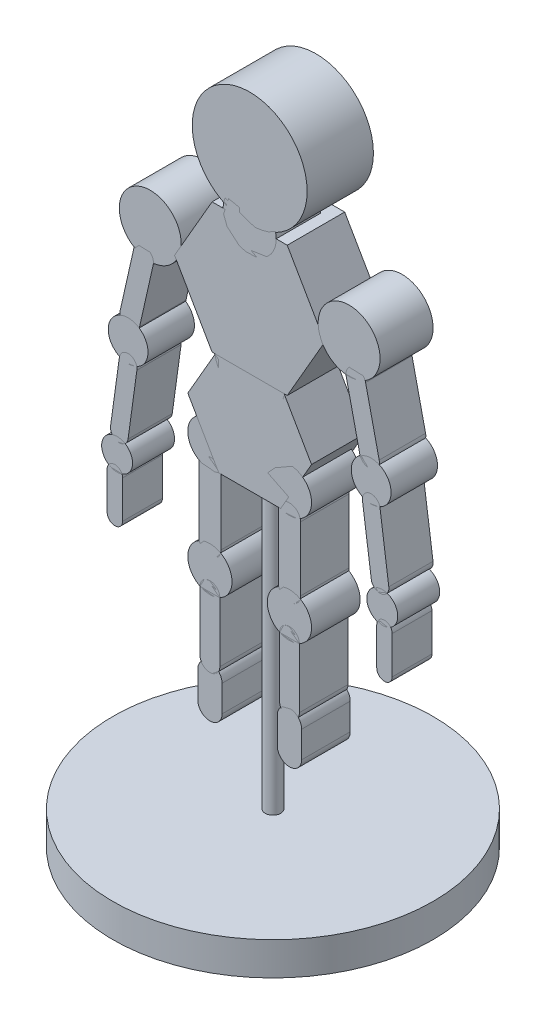
from build123d import *

# Parameters (mm, degrees)
EXTRUDE_2_DEPTH  = 22
EXTRUDE_3_DEPTH  = 22
EXTRUDE_4_DEPTH  = 22
SKETCH_5_R       = 10
EXTRUDE_5_DEPTH  = 22
EXTRUDE_6_DEPTH  = 22
SKETCH_7_R       = 10
EXTRUDE_7_DEPTH  = 22
EXTRUDE_8_DEPTH  = 22
SKETCH_9_R       = 10
EXTRUDE_9_DEPTH  = 22
EXTRUDE_10_DEPTH = 22
SKETCH_11_R      = 10
EXTRUDE_11_DEPTH = 22
EXTRUDE_12_DEPTH = 24
SKETCH_13_R      = 16
EXTRUDE_13_DEPTH = 22
EXTRUDE_14_DEPTH = 26
SKETCH_15_R      = 12
EXTRUDE_15_DEPTH = 20
SKETCH_16_R      = 26
EXTRUDE_16_DEPTH = 30
SKETCH_17_R      = 14
EXTRUDE_17_DEPTH = 24
EXTRUDE_18_DEPTH = 21
SKETCH_19_R      = 9
EXTRUDE_19_DEPTH = 21
EXTRUDE_20_DEPTH = 20
SKETCH_21_R      = 7
EXTRUDE_21_DEPTH = 19
EXTRUDE_22_DEPTH = 18
SKETCH_23_R      = 14
EXTRUDE_23_DEPTH = 24
EXTRUDE_24_DEPTH = 21
SKETCH_25_R      = 9
EXTRUDE_25_DEPTH = 21
EXTRUDE_26_DEPTH = 20
SKETCH_27_R      = 7
EXTRUDE_27_DEPTH = 19
EXTRUDE_28_DEPTH = 18
SKETCH_29_R      = 3.5
EXTRUDE_29_DEPTH = 130
SKETCH_30_R      = 72.5
EXTRUDE_30_DEPTH = 15


with BuildPart() as part:
    # 草图2 → 凸台-拉伸2 (new body)
    with BuildSketch(Plane.XY):
        with BuildLine():
            Line((-23.5, -111), (-23.5, -99))
            ThreePointArc((-23.5, -99), (-18, -93.5), (-12.5, -99))
            Line((-12.5, -99), (-12.5, -111))
            ThreePointArc((-12.5, -111), (-18, -116.5), (-23.5, -111))
        make_face()
    extrude(amount=-EXTRUDE_2_DEPTH)


with BuildPart() as body_2:
    # 草图3 → 凸台-拉伸3 (new body)
    with BuildSketch(Plane.XY):
        with BuildLine():
            Line((12.5, -111), (12.5, -99))
            ThreePointArc((12.5, -99), (18, -93.5), (23.5, -99))
            Line((23.5, -99), (23.5, -111))
            ThreePointArc((23.5, -111), (18, -116.5), (12.5, -111))
        make_face()
    extrude(amount=-EXTRUDE_3_DEPTH)


with BuildPart() as body_3:
    # 草图4 → 凸台-拉伸4 (new body)
    with BuildSketch(Plane.XY):
        with BuildLine():
            Line((-22.5, -93), (-22.5, -66))
            ThreePointArc((-22.5, -66), (-18, -61.5), (-13.5, -66))
            Line((-13.5, -66), (-13.5, -93))
            ThreePointArc((-13.5, -93), (-18, -97.5), (-22.5, -93))
        make_face()
    extrude(amount=-EXTRUDE_4_DEPTH)


with BuildPart() as body_4:
    # 草图5 → 凸台-拉伸5 (new body)
    with BuildSketch(Plane.XY):
        with Locations((-18, -57)):
            Circle(SKETCH_5_R)
    extrude(amount=-EXTRUDE_5_DEPTH)


with BuildPart() as body_5:
    # 草图6 → 凸台-拉伸6 (new body)
    with BuildSketch(Plane.XY):
        with BuildLine():
            Line((-23, -47), (-23, -18))
            ThreePointArc((-23, -18), (-18, -13), (-13, -18))
            Line((-13, -18), (-13, -47))
            ThreePointArc((-13, -47), (-18, -52), (-23, -47))
        make_face()
    extrude(amount=-EXTRUDE_6_DEPTH)


with BuildPart() as body_6:
    # 草图7 → 凸台-拉伸7 (new body)
    with BuildSketch(Plane.XY):
        with Locations((-18, -8)):
            Circle(SKETCH_7_R)
    extrude(amount=-EXTRUDE_7_DEPTH)


with BuildPart() as body_7:
    # 草图8 → 凸台-拉伸8 (new body)
    with BuildSketch(Plane.XY):
        with BuildLine():
            Line((13.5, -93), (13.5, -66))
            ThreePointArc((13.5, -66), (18, -61.5), (22.5, -66))
            Line((22.5, -66), (22.5, -93))
            ThreePointArc((22.5, -93), (18, -97.5), (13.5, -93))
        make_face()
    extrude(amount=-EXTRUDE_8_DEPTH)


with BuildPart() as body_8:
    # 草图9 → 凸台-拉伸9 (new body)
    with BuildSketch(Plane.XY):
        with Locations((18, -57)):
            Circle(SKETCH_9_R)
    extrude(amount=-EXTRUDE_9_DEPTH)


with BuildPart() as body_9:
    # 草图10 → 凸台-拉伸10 (new body)
    with BuildSketch(Plane.XY):
        with BuildLine():
            Line((13, -47), (13, -18))
            ThreePointArc((13, -18), (18, -13), (23, -18))
            Line((23, -18), (23, -47))
            ThreePointArc((23, -47), (18, -52), (13, -47))
        make_face()
    extrude(amount=-EXTRUDE_10_DEPTH)


with BuildPart() as body_10:
    # 草图11 → 凸台-拉伸11 (new body)
    with BuildSketch(Plane.XY):
        with Locations((18, -8)):
            Circle(SKETCH_11_R)
    extrude(amount=-EXTRUDE_11_DEPTH)


with BuildPart() as body_11:
    # 草图12 → 凸台-拉伸12 (new body)
    with BuildSketch(Plane.XY):
        Polygon((28, 7), (14, 31.248711306), (-14, 31.248711306), (-28, 7), (-14, -17.248711306), (14, -17.248711306), align=None)
    extrude(amount=-EXTRUDE_12_DEPTH)

    # 草图29 → 凸台-拉伸29 (add)
    with BuildSketch(Plane.XZ.offset(17.248711306)):
        with Locations((0, -10.528596481)):
            Circle(SKETCH_29_R)
    extrude(amount=EXTRUDE_29_DEPTH)

    # 草图30 → 凸台-拉伸30 (add)
    with BuildSketch(Plane.XZ.offset(147.248711306)):
        with Locations((0, -10.528596481)):
            Circle(SKETCH_30_R)
    extrude(amount=EXTRUDE_30_DEPTH)


with BuildPart() as body_12:
    # 草图13 → 凸台-拉伸13 (new body)
    with BuildSketch(Plane.XY):
        with Locations((0, 31.248711306)):
            Circle(SKETCH_13_R)
    extrude(amount=-EXTRUDE_13_DEPTH)


with BuildPart() as body_13:
    # 草图14 → 凸台-拉伸14 (new body)
    with BuildSketch(Plane.XY):
        Polygon((34, 58), (17, 87.444863729), (-17, 87.444863729), (-34, 58), (-17, 28.555136271), (17, 28.555136271), align=None)
    extrude(amount=-EXTRUDE_14_DEPTH)


with BuildPart() as body_14:
    # 草图15 → 凸台-拉伸15 (new body)
    with BuildSketch(Plane.XY):
        with Locations((0, 87.444863729)):
            Circle(SKETCH_15_R)
    extrude(amount=-EXTRUDE_15_DEPTH)


with BuildPart() as body_15:
    # 草图16 → 凸台-拉伸16 (new body)
    with BuildSketch(Plane.XY):
        with Locations((0, 113)):
            Circle(SKETCH_16_R)
    extrude(amount=-EXTRUDE_16_DEPTH)


with BuildPart() as body_16:
    # 草图17 → 凸台-拉伸17 (new body)
    with BuildSketch(Plane.XY):
        with Locations((-45, 64)):
            Circle(SKETCH_17_R)
    extrude(amount=-EXTRUDE_17_DEPTH)


with BuildPart() as body_17:
    # 草图18 → 凸台-拉伸18 (new body)
    with BuildSketch(Plane.XY):
        with BuildLine():
            Line((-43.682926829, 49.353658537), (-49.823914337, 22.060380726))
            ThreePointArc((-49.823914337, 22.060380726), (-55.201963117, 18.657941701), (-58.604402142, 24.035990482))
            Line((-58.604402142, 24.035990482), (-52.463414634, 51.329268293))
            ThreePointArc((-52.463414634, 51.329268293), (-47.085365854, 54.731707317), (-43.682926829, 49.353658537))
        make_face()
    extrude(amount=-EXTRUDE_18_DEPTH)


with BuildPart() as body_18:
    # 草图19 → 凸台-拉伸19 (new body)
    with BuildSketch(Plane.XY):
        with Locations((-55, 14)):
            Circle(SKETCH_19_R)
    extrude(amount=-EXTRUDE_19_DEPTH)


with BuildPart() as body_19:
    # 草图20 → 凸台-拉伸20 (new body)
    with BuildSketch(Plane.XY):
        with BuildLine():
            Line((-51.037515483, 4.453450411), (-55.037515483, -24.546549589))
            ThreePointArc((-55.037515483, -24.546549589), (-59.546549589, -27.962484517), (-62.962484517, -23.453450411))
            Line((-62.962484517, -23.453450411), (-58.962484517, 5.546549589))
            ThreePointArc((-58.962484517, 5.546549589), (-54.453450411, 8.962484517), (-51.037515483, 4.453450411))
        make_face()
    extrude(amount=-EXTRUDE_20_DEPTH)


with BuildPart() as body_20:
    # 草图21 → 凸台-拉伸21 (new body)
    with BuildSketch(Plane.XY):
        with Locations((-60, -33)):
            Circle(SKETCH_21_R)
    extrude(amount=-EXTRUDE_21_DEPTH)


with BuildPart() as body_21:
    # 草图22 → 凸台-拉伸22 (new body)
    with BuildSketch(Plane.XY):
        with BuildLine():
            Line((-57.5, -41), (-57.5, -58))
            ThreePointArc((-57.5, -58), (-61, -61.5), (-64.5, -58))
            Line((-64.5, -58), (-64.5, -41))
            ThreePointArc((-64.5, -41), (-61, -37.5), (-57.5, -41))
        make_face()
    extrude(amount=-EXTRUDE_22_DEPTH)


with BuildPart() as body_22:
    # 草图23 → 凸台-拉伸23 (new body)
    with BuildSketch(Plane.XY):
        with Locations((45, 64)):
            Circle(SKETCH_23_R)
    extrude(amount=-EXTRUDE_23_DEPTH)


with BuildPart() as body_23:
    # 草图24 → 凸台-拉伸24 (new body)
    with BuildSketch(Plane.XY):
        with BuildLine():
            Line((52.463414634, 51.329268293), (58.604402142, 24.035990482))
            ThreePointArc((58.604402142, 24.035990482), (55.201963117, 18.657941701), (49.823914337, 22.060380726))
            Line((49.823914337, 22.060380726), (43.682926829, 49.353658537))
            ThreePointArc((43.682926829, 49.353658537), (47.085365854, 54.731707317), (52.463414634, 51.329268293))
        make_face()
    extrude(amount=-EXTRUDE_24_DEPTH)


with BuildPart() as body_24:
    # 草图25 → 凸台-拉伸25 (new body)
    with BuildSketch(Plane.XY):
        with Locations((55, 14)):
            Circle(SKETCH_25_R)
    extrude(amount=-EXTRUDE_25_DEPTH)


with BuildPart() as body_25:
    # 草图26 → 凸台-拉伸26 (new body)
    with BuildSketch(Plane.XY):
        with BuildLine():
            Line((58.962484517, 5.546549589), (62.962484517, -23.453450411))
            ThreePointArc((62.962484517, -23.453450411), (59.546549589, -27.962484517), (55.037515483, -24.546549589))
            Line((55.037515483, -24.546549589), (51.037515483, 4.453450411))
            ThreePointArc((51.037515483, 4.453450411), (54.453450411, 8.962484517), (58.962484517, 5.546549589))
        make_face()
    extrude(amount=-EXTRUDE_26_DEPTH)


with BuildPart() as body_26:
    # 草图27 → 凸台-拉伸27 (new body)
    with BuildSketch(Plane.XY):
        with Locations((60, -33)):
            Circle(SKETCH_27_R)
    extrude(amount=-EXTRUDE_27_DEPTH)


with BuildPart() as body_27:
    # 草图28 → 凸台-拉伸28 (new body)
    with BuildSketch(Plane.XY):
        with BuildLine():
            Line((64.5, -41), (64.5, -58))
            ThreePointArc((64.5, -58), (61, -61.5), (57.5, -58))
            Line((57.5, -58), (57.5, -41))
            ThreePointArc((57.5, -41), (61, -37.5), (64.5, -41))
        make_face()
    extrude(amount=-EXTRUDE_28_DEPTH)


solid = Compound([part.part, body_2.part, body_3.part, body_4.part, body_5.part, body_6.part, body_7.part, body_8.part, body_9.part, body_10.part, body_11.part, body_12.part, body_13.part, body_14.part, body_15.part, body_16.part, body_17.part, body_18.part, body_19.part, body_20.part, body_21.part, body_22.part, body_23.part, body_24.part, body_25.part, body_26.part, body_27.part])
